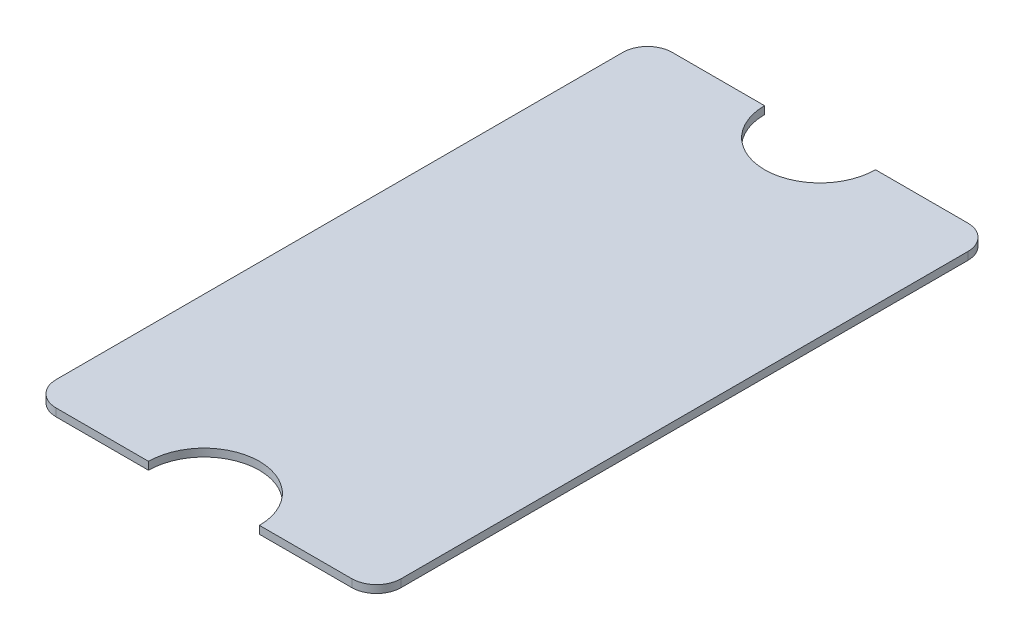
from build123d import *

# Parameters (mm, degrees)
EXTRUDE_1_DEPTH = 0.63
FILLET_3_R      = 2


with BuildPart() as part:
    # Эскиз1 → Бобышка-Вытянуть1 (new body)
    with BuildSketch(Plane(origin=(0, 0, 0), x_dir=(1, 0, 0), z_dir=(0, 1, 0))):
        with BuildLine():
            Line((5.101078805, 0), (14.601078805, 0))
            Line((14.601078805, 0), (14.601078805, 50))
            Line((14.601078805, 50), (5.101078805, 50))
            ThreePointArc((5.101078805, 50), (0.601078805, 45.5), (-3.898921195, 50))
            Line((-3.898921195, 50), (-13.398921195, 50))
            Line((-13.398921195, 50), (-13.398921195, 0))
            Line((-13.398921195, 0), (-3.898921195, 0))
            ThreePointArc((-3.898921195, 0), (0.601078805, 4.5), (5.101078805, 0))
        make_face()
    extrude(amount=-EXTRUDE_1_DEPTH)

    # Скругление3
    fillet_3_edges = [part.edges().sort_by_distance(p)[0] for p in [
        (14.601078805, -0.315, -50),
        (-13.398921195, -0.315, -50),
        (-13.398921195, -0.315, 0),
        (14.601078805, -0.315, 0),
    ]]
    fillet(fillet_3_edges, radius=FILLET_3_R)


solid = part.part
